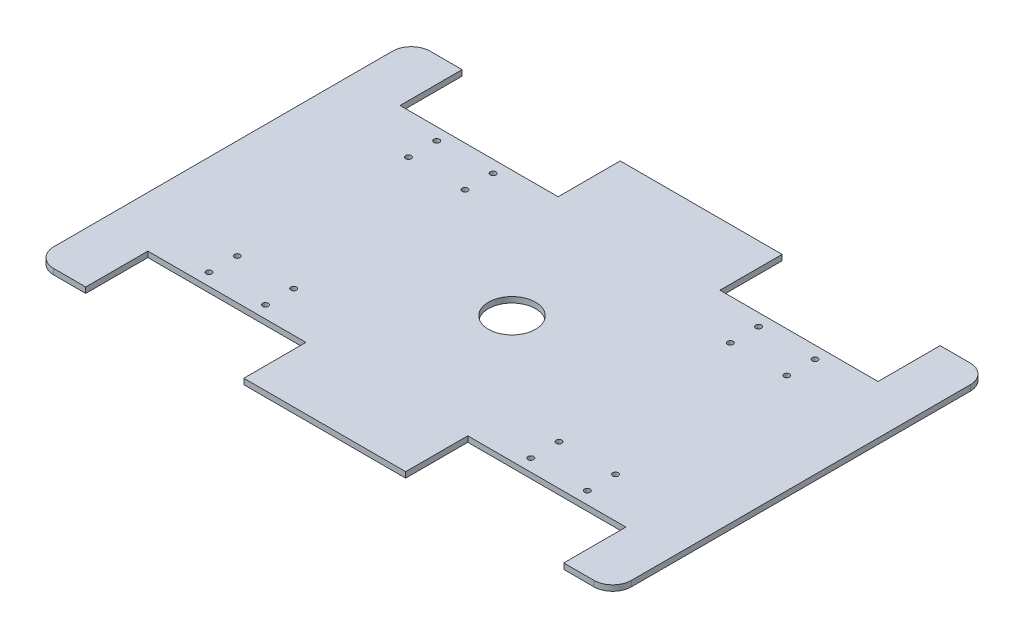
from build123d import *

# Parameters (mm, degrees)
SKETCH_1_W                                 = 307
SKETCH_1_H                                 = 200
EXTRUDE_1_DEPTH                            = 3
SKETCH_2_W                                 = 84
SKETCH_2_H                                 = 33
CUT_EXTRUDE_1_DEPTH                        = 3
PATTERN_LINEAR_1_COUNT                     = 2
PATTERN_LINEAR_1_PITCH                     = 170
PATTERN_LINEAR_1_COUNT_DIR2                = 2
PATTERN_LINEAR_1_PITCH_DIR2                = 167
SKETCH_6_R                                 = 12.5
CUT_EXTRUDE_2_DEPTH                        = 3
FILLET_1_R                                 = 10
SKETCH_11_R                                = 1.5
CUT_EXTRUDE_3_DEPTH                        = 10
SKETCH_11_3_R                              = 1.5
CUT_EXTRUDE_4_DEPTH                        = 10
MIRROR_2_AT_THE_SECOND_PLANE_COPY_1_SKET_R = 1.5
MIRROR_2_AT_THE_SECOND_PLANE_COPY_1_DEPTH  = 10
MIRROR_2_AT_THE_SECOND_PLANE_COPY_2_SKET_R = 1.5
MIRROR_2_AT_THE_SECOND_PLANE_COPY_2_DEPTH  = 10


with BuildPart() as part:
    # 草图1 → 凸台-拉伸1 (new body)
    with BuildSketch(Plane(origin=(0, 0, 0), x_dir=(1, 0, 0), z_dir=(0, 1, 0))):
        with Locations((-43.995626822, 46.034985423)):
            Rectangle(SKETCH_1_W, SKETCH_1_H)
    extrude(amount=EXTRUDE_1_DEPTH)

    # 草图2 → 切除-拉伸1 (cut)
    with BuildSketch(Plane(origin=(0, 3, 0), x_dir=(1, 0, 0), z_dir=(0, 1, 0))):
        with Locations((-128.495626822, 129.534985423)):
            Rectangle(SKETCH_2_W, SKETCH_2_H)
    cut_extrude_1 = extrude(amount=-CUT_EXTRUDE_1_DEPTH, mode=Mode.SUBTRACT)

    # 阵列(线性)1: Cut-Extrude 1 2 × 2
    with Locations(*[(i * PATTERN_LINEAR_1_PITCH, 0, j * PATTERN_LINEAR_1_PITCH_DIR2) for i in range(PATTERN_LINEAR_1_COUNT) for j in range(PATTERN_LINEAR_1_COUNT_DIR2) if (i, j) != (0, 0)]):
        add(cut_extrude_1, mode=Mode.SUBTRACT)

    # 草图6 → 切除-拉伸2 (cut)
    with BuildSketch(Plane(origin=(0, 3, 0), x_dir=(1, 0, 0), z_dir=(0, 1, 0))):
        with Locations((-43.995626822, 46.034985423)):
            Circle(SKETCH_6_R)
    extrude(amount=-CUT_EXTRUDE_2_DEPTH, mode=Mode.SUBTRACT)

    # 圆角1
    fillet_1_edges = [part.edges().sort_by_distance(p)[0] for p in [
        (-197.495626822, 1.5, -146.034985423),
        (-197.495626822, 1.5, 53.965014577),
        (109.504373178, 1.5, 53.965014577),
        (109.504373178, 1.5, -146.034985423),
    ]]
    fillet(fillet_1_edges, radius=FILLET_1_R)

    # 草图11 → 切除-拉伸3 (cut)
    with BuildSketch(Plane.XZ):
        with Locations((26.504373178, 14.465014577)):
            Circle(SKETCH_11_R)
        with Locations((56.504373178, 14.465014577)):
            Circle(SKETCH_11_R)
    cut_extrude_3 = extrude(amount=-CUT_EXTRUDE_3_DEPTH, mode=Mode.SUBTRACT)

    # 草图11<3> → 切除-拉伸4 (cut)
    with BuildSketch(Plane.XZ):
        with Locations((26.504373178, 14.465014577)):
            Circle(SKETCH_11_3_R)
        with Locations((56.504373178, 14.465014577)):
            Circle(SKETCH_11_3_R)
        with Locations((56.504373178, -0.534985423)):
            Circle(SKETCH_11_3_R)
        with Locations((26.504373178, -0.534985423)):
            Circle(SKETCH_11_3_R)
    cut_extrude_4 = extrude(amount=-CUT_EXTRUDE_4_DEPTH, mode=Mode.SUBTRACT)

    # 镜向2: 切除-拉伸3, 切除-拉伸4 across plane
    add(cut_extrude_3.mirror(Plane(origin=(-43.995626822, 0, 0), x_dir=(0, 0, 1), z_dir=(1, 0, 0))), mode=Mode.SUBTRACT)
    add(cut_extrude_4.mirror(Plane(origin=(-43.995626822, 0, 0), x_dir=(0, 0, 1), z_dir=(1, 0, 0))), mode=Mode.SUBTRACT)

    # 镜向2 at the second plane: 切除-拉伸3, 切除-拉伸4 across plane
    add(cut_extrude_3.mirror(Plane(origin=(0, 0, -46.034985423), x_dir=(1, 0, 0), z_dir=(0, 0, -1))), mode=Mode.SUBTRACT)
    add(cut_extrude_4.mirror(Plane(origin=(0, 0, -46.034985423), x_dir=(1, 0, 0), z_dir=(0, 0, -1))), mode=Mode.SUBTRACT)

    # 镜向2 at the second plane copy 1 sket → 镜向2 at the second plane copy 1 (cut)
    with BuildSketch(Plane(origin=(-87.991253644, 0, -92.069970845), x_dir=(-1, 0, 0), z_dir=(0, -1, 0))):
        with Locations((26.504373178, 14.465014577)):
            Circle(MIRROR_2_AT_THE_SECOND_PLANE_COPY_1_SKET_R)
        with Locations((56.504373178, 14.465014577)):
            Circle(MIRROR_2_AT_THE_SECOND_PLANE_COPY_1_SKET_R)
    extrude(amount=-MIRROR_2_AT_THE_SECOND_PLANE_COPY_1_DEPTH, mode=Mode.SUBTRACT)

    # 镜向2 at the second plane copy 2 sket → 镜向2 at the second plane copy 2 (cut)
    with BuildSketch(Plane(origin=(-87.991253644, 0, -92.069970845), x_dir=(-1, 0, 0), z_dir=(0, -1, 0))):
        with Locations((26.504373178, 14.465014577)):
            Circle(MIRROR_2_AT_THE_SECOND_PLANE_COPY_2_SKET_R)
        with Locations((56.504373178, 14.465014577)):
            Circle(MIRROR_2_AT_THE_SECOND_PLANE_COPY_2_SKET_R)
        with Locations((56.504373178, -0.534985423)):
            Circle(MIRROR_2_AT_THE_SECOND_PLANE_COPY_2_SKET_R)
        with Locations((26.504373178, -0.534985423)):
            Circle(MIRROR_2_AT_THE_SECOND_PLANE_COPY_2_SKET_R)
    extrude(amount=-MIRROR_2_AT_THE_SECOND_PLANE_COPY_2_DEPTH, mode=Mode.SUBTRACT)


solid = part.part
